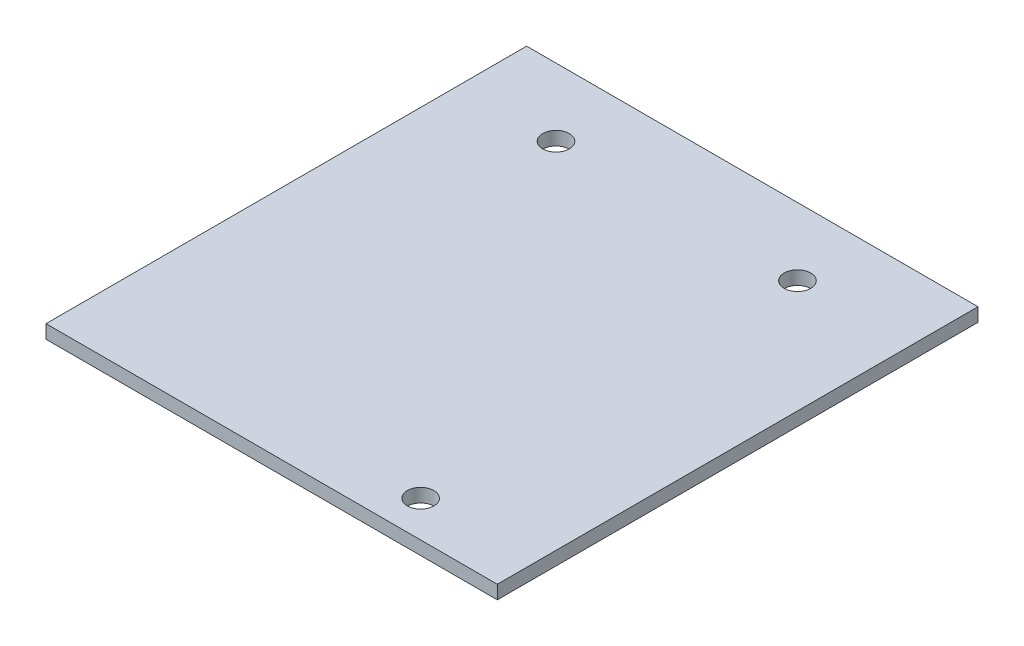
from build123d import *

# Parameters (mm, degrees)
SKETCH1_W           = 50.8
SKETCH1_H           = 54.102
BOSS_EXTRUDE1_DEPTH = 1.524
SKETCH2_R           = 1.4986
CUT_EXTRUDE1_DEPTH  = 1.524


with BuildPart() as part:
    # Sketch1 → Boss-Extrude1 (new body)
    with BuildSketch(Plane(origin=(0, 0, 0), x_dir=(1, 0, 0), z_dir=(0, 1, 0))):
        Rectangle(SKETCH1_W, SKETCH1_H)
    extrude(amount=BOSS_EXTRUDE1_DEPTH)

    # Sketch2 → Cut-Extrude1 (cut)
    with BuildSketch(Plane(origin=(0, 1.524, 0), x_dir=(1, 0, 0), z_dir=(0, 1, 0))):
        with Locations(Location((-14.478, 19.431, 0), (0, 0, 270))):
            Circle(SKETCH2_R)
        with Locations(Location((12.7, 19.431, 0), (0, 0, 270))):
            Circle(SKETCH2_R)
        with Locations(Location((12.7, -22.987, 0), (0, 0, 270))):
            Circle(SKETCH2_R)
    extrude(amount=-CUT_EXTRUDE1_DEPTH, mode=Mode.SUBTRACT)


solid = part.part
